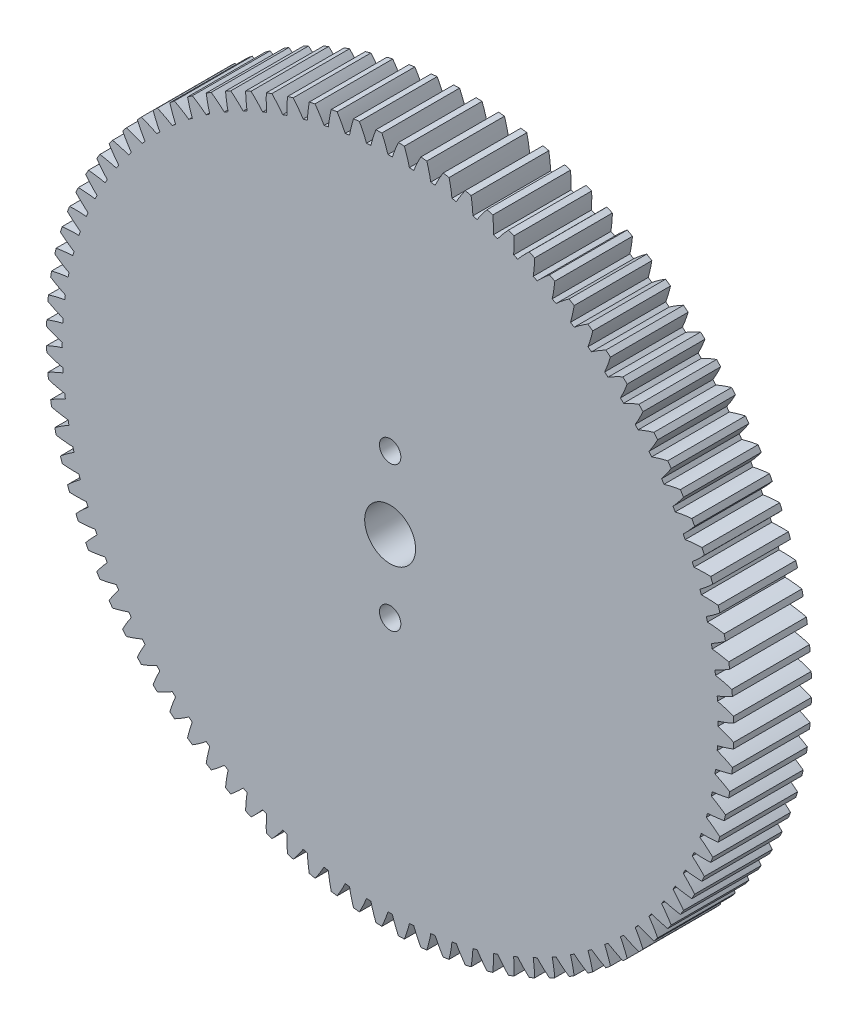
from build123d import *

# Parameters (mm, degrees)
MODEL_R             = 1.375
MODEL_R_2           = 3.275
BOSS_EXTRUDE1_DEPTH = 10


with BuildPart() as part:
    # Model → Boss-Extrude1 (new body)
    with BuildSketch(Plane.XY):
        with BuildLine():
            ThreePointArc((41.873890298, 5.228088781), (41.837981705, 5.508074786), (41.800201032, 5.787814326))
            ThreePointArc((41.800201032, 5.787814326), (42.763794154, 6.277066745), (43.695166566, 6.825177194))
            ThreePointArc((43.695166566, 6.825177194), (43.634301361, 7.204052311), (43.570151043, 7.582385053))
            ThreePointArc((43.570151043, 7.582385053), (42.512022114, 7.802027502), (41.442301719, 7.9555785))
            ThreePointArc((41.442301719, 7.9555785), (41.388158048, 8.232616499), (41.332162425, 8.509286121))
            ThreePointArc((41.332162425, 8.509286121), (42.261693781, 9.060513019), (43.155223915, 9.668364591))
            ThreePointArc((43.155223915, 9.668364591), (43.069709409, 10.042447733), (42.980952296, 10.415774804))
            ThreePointArc((42.980952296, 10.415774804), (41.910723599, 10.565742038), (40.833250841, 10.649001211))
            ThreePointArc((40.833250841, 10.649001211), (40.761103944, 10.921904884), (40.687133152, 11.194319847))
            ThreePointArc((40.687133152, 11.194319847), (41.578622347, 11.805160785), (42.430483969, 12.470150567))
            ThreePointArc((42.430483969, 12.470150567), (42.320686348, 12.837839852), (42.207702512, 13.204562608))
            ThreePointArc((42.207702512, 13.204562608), (41.129956931, 13.284212445), (40.049345714, 13.296823263))
            ThreePointArc((40.049345714, 13.296823263), (39.959504535, 13.564423996), (39.86787533, 13.831417776))
            ThreePointArc((39.86787533, 13.831417776), (40.717504868, 14.49925704), (41.524050177, 15.218537444))
            ThreePointArc((41.524050177, 15.218537444), (41.390439611, 15.578258369), (41.253712866, 15.936806448))
            ThreePointArc((41.253712866, 15.936806448), (40.173065472, 15.945797815), (39.09394314, 15.887706277))
            ThreePointArc((39.09394314, 15.887706277), (38.986792392, 16.148858162), (38.877897144, 16.409287452))
            ThreePointArc((38.877897144, 16.409287452), (39.682028783, 17.13126525), (40.439804027, 17.901756207))
            ThreePointArc((40.439804027, 17.901756207), (40.282952657, 18.251968393), (40.123068489, 18.600806436))
            ThreePointArc((40.123068489, 18.600806436), (39.04414678, 18.53910083), (37.9711343, 18.410555694))
            ThreePointArc((37.9711343, 18.410555694), (37.84713282, 18.664140439), (37.721437834, 18.916890039))
            ThreePointArc((37.721437834, 18.916890039), (38.476628158, 19.689914753), (39.182388427, 20.508316902))
            ThreePointArc((39.182388427, 20.508316902), (39.002967916, 20.847520686), (38.820610972, 21.185154915))
            ThreePointArc((38.820610972, 21.185154915), (37.748035057, 21.05301657), (36.685727234, 20.854568285))
            ThreePointArc((36.685727234, 20.854568285), (36.545406014, 21.0995), (36.403449536, 21.343487598))
            ThreePointArc((36.403449536, 21.343487598), (37.106464705, 22.164249018), (37.757187825, 23.027057835))
            ThreePointArc((37.757187825, 23.027057835), (37.555966478, 23.353800695), (37.351917639, 23.678785308))
            ThreePointArc((37.351917639, 23.678785308), (36.290280453, 23.47678006), (35.243226251, 23.209278412))
            ThreePointArc((35.243226251, 23.209278412), (35.08718617, 23.444508263), (34.929576079, 23.678689068))
            ThreePointArc((34.929576079, 23.678689068), (35.577405672, 24.543672566), (36.170305149, 25.447193371))
            ThreePointArc((36.170305149, 25.447193371), (35.948144626, 25.760076144), (35.723277661, 26.071019508))
            ThreePointArc((35.723277661, 26.071019508), (34.677125297, 25.800012374), (33.649808363, 25.464602847))
            ThreePointArc((33.649808363, 25.464602847), (33.478717607, 25.689123543), (33.306128814, 25.912494755))
            ThreePointArc((33.306128814, 25.912494755), (33.895998727, 26.81799634), (34.428535672, 27.758360119))
            ThreePointArc((34.428535672, 27.758360119), (34.1863873, 28.056042992), (33.941665123, 28.351613599))
            ThreePointArc((33.941665123, 28.351613599), (32.915477366, 28.012765075), (31.91229683, 27.610883942))
            ThreePointArc((31.91229683, 27.610883942), (31.726888036, 27.823734051), (31.540059592, 28.035339162))
            ThreePointArc((31.540059592, 28.035339162), (32.069443912, 28.977481336), (32.53933792, 29.950661307))
            ThreePointArc((32.53933792, 29.950661307), (32.278238615, 30.231869557), (32.014709165, 30.510801728))
            ThreePointArc((32.014709165, 30.510801728), (31.012880309, 30.105562814), (30.038131942, 29.638930994))
            ThreePointArc((30.038131942, 29.638930994), (29.839199059, 29.839199059), (29.638930994, 30.038131942))
            ThreePointArc((29.638930994, 30.038131942), (30.105562814, 31.012880309), (30.510801728, 32.014709165))
            ThreePointArc((30.510801728, 32.014709165), (30.231869557, 32.278238615), (29.950661307, 32.53933792))
            ThreePointArc((29.950661307, 32.53933792), (28.977481336, 32.069443912), (28.035339162, 31.540059593))
            ThreePointArc((28.035339162, 31.540059593), (27.823734051, 31.726888036), (27.610883942, 31.91229683))
            ThreePointArc((27.610883942, 31.91229683), (28.012765075, 32.915477366), (28.351613599, 33.941665123))
            ThreePointArc((28.351613599, 33.941665123), (28.056042992, 34.1863873), (27.758360119, 34.428535672))
            ThreePointArc((27.758360119, 34.428535672), (26.81799634, 33.895998727), (25.912494755, 33.306128814))
            ThreePointArc((25.912494755, 33.306128814), (25.689123543, 33.478717607), (25.464602846, 33.649808363))
            ThreePointArc((25.464602846, 33.649808363), (25.800012374, 34.677125297), (26.071019508, 35.723277661))
            ThreePointArc((26.071019508, 35.723277661), (25.760076144, 35.948144626), (25.447193371, 36.170305149))
            ThreePointArc((25.447193371, 36.170305149), (24.543672566, 35.577405673), (23.678689068, 34.929576079))
            ThreePointArc((23.678689068, 34.929576079), (23.444508263, 35.08718617), (23.209278412, 35.243226251))
            ThreePointArc((23.209278412, 35.243226251), (23.47678006, 36.290280453), (23.678785308, 37.351917639))
            ThreePointArc((23.678785308, 37.351917639), (23.353800695, 37.555966478), (23.027057835, 37.757187825))
            ThreePointArc((23.027057835, 37.757187825), (22.164249018, 37.106464705), (21.343487598, 36.403449536))
            ThreePointArc((21.343487598, 36.403449536), (21.0995, 36.545406014), (20.854568285, 36.685727234))
            ThreePointArc((20.854568285, 36.685727234), (21.05301657, 37.748035057), (21.185154915, 38.820610972))
            ThreePointArc((21.185154915, 38.820610972), (20.847520686, 39.002967916), (20.508316902, 39.182388427))
            ThreePointArc((20.508316902, 39.182388427), (19.689914753, 38.476628158), (18.916890039, 37.721437834))
            ThreePointArc((18.916890039, 37.721437834), (18.664140439, 37.84713282), (18.410555694, 37.9711343))
            ThreePointArc((18.410555694, 37.9711343), (18.53910083, 39.04414678), (18.600806436, 40.123068489))
            ThreePointArc((18.600806436, 40.123068489), (18.251968393, 40.282952657), (17.901756207, 40.439804027))
            ThreePointArc((17.901756207, 40.439804027), (17.13126525, 39.682028783), (16.409287452, 38.877897144))
            ThreePointArc((16.409287452, 38.877897144), (16.148858162, 38.986792392), (15.887706277, 39.09394314))
            ThreePointArc((15.887706277, 39.09394314), (15.945797815, 40.173065472), (15.936806448, 41.253712866))
            ThreePointArc((15.936806448, 41.253712866), (15.578258369, 41.390439611), (15.218537444, 41.524050177))
            ThreePointArc((15.218537444, 41.524050177), (14.49925704, 40.717504868), (13.831417776, 39.86787533))
            ThreePointArc((13.831417776, 39.86787533), (13.564423996, 39.959504535), (13.296823263, 40.049345714))
            ThreePointArc((13.296823263, 40.049345714), (13.284212445, 41.129956931), (13.204562608, 42.207702512))
            ThreePointArc((13.204562608, 42.207702512), (12.837839852, 42.320686348), (12.470150567, 42.430483969))
            ThreePointArc((12.470150567, 42.430483969), (11.805160785, 41.578622347), (11.194319847, 40.687133152))
            ThreePointArc((11.194319847, 40.687133152), (10.921904884, 40.761103944), (10.649001211, 40.833250841))
            ThreePointArc((10.649001211, 40.833250841), (10.565742038, 41.910723599), (10.415774804, 42.980952295))
            ThreePointArc((10.415774804, 42.980952295), (10.042447733, 43.069709409), (9.668364591, 43.155223915))
            ThreePointArc((9.668364591, 43.155223915), (9.060513019, 42.261693781), (8.509286121, 41.332162425))
            ThreePointArc((8.509286121, 41.332162425), (8.232616499, 41.388158048), (7.9555785, 41.442301719))
            ThreePointArc((7.9555785, 41.442301719), (7.802027502, 42.512022114), (7.582385053, 43.570151043))
            ThreePointArc((7.582385053, 43.570151043), (7.204052311, 43.634301361), (6.825177194, 43.695166566))
            ThreePointArc((6.825177194, 43.695166566), (6.277066745, 42.763794154), (5.787814326, 41.800201032))
            ThreePointArc((5.787814326, 41.800201032), (5.508074785, 41.837981705), (5.228088781, 41.873890298))
            ThreePointArc((5.228088781, 41.873890298), (5.004903486, 42.931277625), (4.716526366, 43.972775715))
            ThreePointArc((4.716526366, 43.972775715), (4.334808031, 44.012044537), (3.95276334, 44.047999807))
            ThreePointArc((3.95276334, 44.047999807), (3.466741108, 43.082773396), (3.041558221, 42.089244761))
            ThreePointArc((3.041558221, 42.089244761), (2.75994665, 42.108648702), (2.478211583, 42.126168451))
            ThreePointArc((2.478211583, 42.126168451), (2.186347705, 43.166694813), (1.830470788, 44.18710221))
            ThreePointArc((1.830470788, 44.18710221), (1.447001438, 44.201321381), (1.063423147, 44.21221275))
            ThreePointArc((1.063423147, 44.21221275), (0.641570353, 43.217265588), (0.282277697, 42.198055883))
            ThreePointArc((0.282277697, 42.198055883), (0, 42.199), (-0.282277698, 42.198055883))
            ThreePointArc((-0.282277698, 42.198055883), (-0.641570353, 43.217265588), (-1.063423147, 44.21221275))
            ThreePointArc((-1.063423147, 44.21221275), (-1.447001438, 44.201321381), (-1.830470788, 44.18710221))
            ThreePointArc((-1.830470788, 44.18710221), (-2.186347705, 43.166694813), (-2.478211583, 42.126168451))
            ThreePointArc((-2.478211583, 42.126168451), (-2.75994665, 42.108648702), (-3.041558221, 42.089244761))
            ThreePointArc((-3.041558221, 42.089244761), (-3.466741108, 43.082773396), (-3.95276334, 44.047999807))
            ThreePointArc((-3.95276334, 44.047999807), (-4.334808031, 44.012044537), (-4.716526366, 43.972775715))
            ThreePointArc((-4.716526366, 43.972775715), (-5.004903486, 42.931277625), (-5.228088781, 41.873890298))
            ThreePointArc((-5.228088781, 41.873890298), (-5.508074786, 41.837981705), (-5.787814326, 41.800201032))
            ThreePointArc((-5.787814326, 41.800201032), (-6.277066745, 42.763794154), (-6.825177194, 43.695166566))
            ThreePointArc((-6.825177194, 43.695166566), (-7.204052311, 43.634301361), (-7.582385053, 43.570151043))
            ThreePointArc((-7.582385053, 43.570151043), (-7.802027502, 42.512022114), (-7.9555785, 41.442301719))
            ThreePointArc((-7.9555785, 41.442301719), (-8.232616499, 41.388158048), (-8.509286121, 41.332162425))
            ThreePointArc((-8.509286121, 41.332162425), (-9.060513019, 42.261693781), (-9.668364591, 43.155223915))
            ThreePointArc((-9.668364591, 43.155223915), (-10.042447733, 43.069709409), (-10.415774804, 42.980952296))
            ThreePointArc((-10.415774804, 42.980952296), (-10.565742038, 41.910723599), (-10.649001211, 40.833250841))
            ThreePointArc((-10.649001211, 40.833250841), (-10.921904884, 40.761103944), (-11.194319847, 40.687133152))
            ThreePointArc((-11.194319847, 40.687133152), (-11.805160785, 41.578622347), (-12.470150567, 42.430483969))
            ThreePointArc((-12.470150567, 42.430483969), (-12.837839852, 42.320686348), (-13.204562608, 42.207702512))
            ThreePointArc((-13.204562608, 42.207702512), (-13.284212445, 41.129956931), (-13.296823263, 40.049345714))
            ThreePointArc((-13.296823263, 40.049345714), (-13.564423996, 39.959504535), (-13.831417776, 39.86787533))
            ThreePointArc((-13.831417776, 39.86787533), (-14.49925704, 40.717504868), (-15.218537444, 41.524050177))
            ThreePointArc((-15.218537444, 41.524050177), (-15.578258369, 41.390439611), (-15.936806448, 41.253712866))
            ThreePointArc((-15.936806448, 41.253712866), (-15.945797815, 40.173065472), (-15.887706277, 39.09394314))
            ThreePointArc((-15.887706277, 39.09394314), (-16.148858162, 38.986792392), (-16.409287451, 38.877897143))
            ThreePointArc((-16.409287451, 38.877897143), (-17.13126525, 39.682028782), (-17.901756207, 40.439804026))
            ThreePointArc((-17.901756207, 40.439804026), (-18.251968393, 40.282952657), (-18.600806436, 40.123068488))
            ThreePointArc((-18.600806436, 40.123068488), (-18.53910083, 39.04414678), (-18.410555694, 37.9711343))
            ThreePointArc((-18.410555694, 37.9711343), (-18.664140438, 37.847132819), (-18.916890038, 37.721437833))
            ThreePointArc((-18.916890038, 37.721437833), (-19.689914753, 38.476628158), (-20.508316901, 39.182388427))
            ThreePointArc((-20.508316901, 39.182388427), (-20.847520686, 39.002967915), (-21.185154915, 38.820610971))
            ThreePointArc((-21.185154915, 38.820610971), (-21.05301657, 37.748035057), (-20.854568284, 36.685727233))
            ThreePointArc((-20.854568284, 36.685727233), (-21.0995, 36.545406014), (-21.343487598, 36.403449536))
            ThreePointArc((-21.343487598, 36.403449536), (-22.164249018, 37.106464704), (-23.027057834, 37.757187825))
            ThreePointArc((-23.027057834, 37.757187825), (-23.353800695, 37.555966478), (-23.678785308, 37.351917639))
            ThreePointArc((-23.678785308, 37.351917639), (-23.47678006, 36.290280453), (-23.209278412, 35.243226251))
            ThreePointArc((-23.209278412, 35.243226251), (-23.444508263, 35.087186169), (-23.678689067, 34.929576078))
            ThreePointArc((-23.678689067, 34.929576078), (-24.543672565, 35.577405672), (-25.447193371, 36.170305148))
            ThreePointArc((-25.447193371, 36.170305148), (-25.760076144, 35.948144626), (-26.071019507, 35.72327766))
            ThreePointArc((-26.071019507, 35.72327766), (-25.800012374, 34.677125297), (-25.464602846, 33.649808363))
            ThreePointArc((-25.464602846, 33.649808363), (-25.689123542, 33.478717607), (-25.912494755, 33.306128814))
            ThreePointArc((-25.912494755, 33.306128814), (-26.817996339, 33.895998727), (-27.758360118, 34.428535672))
            ThreePointArc((-27.758360118, 34.428535672), (-28.056042992, 34.1863873), (-28.351613599, 33.941665123))
            ThreePointArc((-28.351613599, 33.941665123), (-28.012765074, 32.915477366), (-27.610883942, 31.912296829))
            ThreePointArc((-27.610883942, 31.912296829), (-27.823734051, 31.726888035), (-28.035339161, 31.540059592))
            ThreePointArc((-28.035339161, 31.540059592), (-28.977481336, 32.069443912), (-29.950661306, 32.53933792))
            ThreePointArc((-29.950661306, 32.53933792), (-30.231869557, 32.278238615), (-30.510801728, 32.014709164))
            ThreePointArc((-30.510801728, 32.014709164), (-30.105562814, 31.012880308), (-29.638930993, 30.038131941))
            ThreePointArc((-29.638930993, 30.038131941), (-29.839199059, 29.839199059), (-30.038131941, 29.638930993))
            ThreePointArc((-30.038131941, 29.638930993), (-31.012880308, 30.105562814), (-32.014709164, 30.510801728))
            ThreePointArc((-32.014709164, 30.510801728), (-32.278238615, 30.231869557), (-32.53933792, 29.950661306))
            ThreePointArc((-32.53933792, 29.950661306), (-32.069443912, 28.977481336), (-31.540059592, 28.035339161))
            ThreePointArc((-31.540059592, 28.035339161), (-31.726888035, 27.823734051), (-31.912296829, 27.610883942))
            ThreePointArc((-31.912296829, 27.610883942), (-32.915477366, 28.012765074), (-33.941665123, 28.351613599))
            ThreePointArc((-33.941665123, 28.351613599), (-34.1863873, 28.056042992), (-34.428535672, 27.758360118))
            ThreePointArc((-34.428535672, 27.758360118), (-33.895998727, 26.817996339), (-33.306128814, 25.912494755))
            ThreePointArc((-33.306128814, 25.912494755), (-33.478717607, 25.689123542), (-33.649808363, 25.464602846))
            ThreePointArc((-33.649808363, 25.464602846), (-34.677125297, 25.800012374), (-35.723277661, 26.071019507))
            ThreePointArc((-35.723277661, 26.071019507), (-35.948144626, 25.760076144), (-36.170305148, 25.447193371))
            ThreePointArc((-36.170305148, 25.447193371), (-35.577405672, 24.543672565), (-34.929576078, 23.678689067))
            ThreePointArc((-34.929576078, 23.678689067), (-35.087186169, 23.444508263), (-35.243226251, 23.209278412))
            ThreePointArc((-35.243226251, 23.209278412), (-36.290280453, 23.47678006), (-37.351917639, 23.678785308))
            ThreePointArc((-37.351917639, 23.678785308), (-37.555966478, 23.353800695), (-37.757187825, 23.027057834))
            ThreePointArc((-37.757187825, 23.027057834), (-37.106464704, 22.164249018), (-36.403449536, 21.343487598))
            ThreePointArc((-36.403449536, 21.343487598), (-36.545406014, 21.0995), (-36.685727233, 20.854568284))
            ThreePointArc((-36.685727233, 20.854568284), (-37.748035057, 21.05301657), (-38.820610972, 21.185154915))
            ThreePointArc((-38.820610972, 21.185154915), (-39.002967916, 20.847520686), (-39.182388427, 20.508316901))
            ThreePointArc((-39.182388427, 20.508316901), (-38.476628158, 19.689914753), (-37.721437834, 18.916890039))
            ThreePointArc((-37.721437834, 18.916890039), (-37.84713282, 18.664140438), (-37.9711343, 18.410555694))
            ThreePointArc((-37.9711343, 18.410555694), (-39.04414678, 18.53910083), (-40.123068488, 18.600806436))
            ThreePointArc((-40.123068488, 18.600806436), (-40.282952657, 18.251968393), (-40.439804026, 17.901756207))
            ThreePointArc((-40.439804026, 17.901756207), (-39.682028783, 17.13126525), (-38.877897144, 16.409287452))
            ThreePointArc((-38.877897144, 16.409287452), (-38.986792392, 16.148858162), (-39.09394314, 15.887706277))
            ThreePointArc((-39.09394314, 15.887706277), (-40.173065472, 15.945797815), (-41.253712866, 15.936806448))
            ThreePointArc((-41.253712866, 15.936806448), (-41.390439611, 15.578258369), (-41.524050176, 15.218537444))
            ThreePointArc((-41.524050176, 15.218537444), (-40.717504868, 14.49925704), (-39.867875329, 13.831417776))
            ThreePointArc((-39.867875329, 13.831417776), (-39.959504534, 13.564423996), (-40.049345714, 13.296823263))
            ThreePointArc((-40.049345714, 13.296823263), (-41.12995693, 13.284212445), (-42.207702512, 13.204562608))
            ThreePointArc((-42.207702512, 13.204562608), (-42.320686348, 12.837839852), (-42.430483969, 12.470150567))
            ThreePointArc((-42.430483969, 12.470150567), (-41.578622346, 11.805160785), (-40.687133152, 11.194319847))
            ThreePointArc((-40.687133152, 11.194319847), (-40.761103943, 10.921904884), (-40.833250841, 10.649001211))
            ThreePointArc((-40.833250841, 10.649001211), (-41.910723599, 10.565742038), (-42.980952295, 10.415774804))
            ThreePointArc((-42.980952295, 10.415774804), (-43.069709408, 10.042447733), (-43.155223915, 9.668364591))
            ThreePointArc((-43.155223915, 9.668364591), (-42.261693781, 9.060513019), (-41.332162425, 8.509286121))
            ThreePointArc((-41.332162425, 8.509286121), (-41.388158048, 8.232616499), (-41.442301718, 7.9555785))
            ThreePointArc((-41.442301718, 7.9555785), (-42.512022114, 7.802027502), (-43.570151043, 7.582385053))
            ThreePointArc((-43.570151043, 7.582385053), (-43.634301361, 7.204052311), (-43.695166566, 6.825177194))
            ThreePointArc((-43.695166566, 6.825177194), (-42.763794154, 6.277066745), (-41.800201032, 5.787814326))
            ThreePointArc((-41.800201032, 5.787814326), (-41.837981705, 5.508074785), (-41.873890298, 5.228088781))
            ThreePointArc((-41.873890298, 5.228088781), (-42.931277625, 5.004903486), (-43.972775715, 4.716526366))
            ThreePointArc((-43.972775715, 4.716526366), (-44.012044537, 4.334808031), (-44.047999807, 3.95276334))
            ThreePointArc((-44.047999807, 3.95276334), (-43.082773396, 3.466741108), (-42.089244761, 3.041558221))
            ThreePointArc((-42.089244761, 3.041558221), (-42.108648702, 2.75994665), (-42.126168451, 2.478211583))
            ThreePointArc((-42.126168451, 2.478211583), (-43.166694813, 2.186347705), (-44.18710221, 1.830470788))
            ThreePointArc((-44.18710221, 1.830470788), (-44.201321381, 1.447001438), (-44.21221275, 1.063423147))
            ThreePointArc((-44.21221275, 1.063423147), (-43.217265588, 0.641570353), (-42.198055883, 0.282277697))
            ThreePointArc((-42.198055883, 0.282277697), (-42.199, 0), (-42.198055883, -0.282277698))
            ThreePointArc((-42.198055883, -0.282277698), (-43.217265588, -0.641570353), (-44.21221275, -1.063423147))
            ThreePointArc((-44.21221275, -1.063423147), (-44.201321381, -1.447001438), (-44.18710221, -1.830470788))
            ThreePointArc((-44.18710221, -1.830470788), (-43.166694813, -2.186347705), (-42.126168451, -2.478211583))
            ThreePointArc((-42.126168451, -2.478211583), (-42.108648702, -2.75994665), (-42.089244761, -3.041558221))
            ThreePointArc((-42.089244761, -3.041558221), (-43.082773396, -3.466741108), (-44.047999807, -3.95276334))
            ThreePointArc((-44.047999807, -3.95276334), (-44.012044537, -4.334808031), (-43.972775715, -4.716526366))
            ThreePointArc((-43.972775715, -4.716526366), (-42.931277625, -5.004903486), (-41.873890298, -5.228088781))
            ThreePointArc((-41.873890298, -5.228088781), (-41.837981705, -5.508074786), (-41.800201032, -5.787814326))
            ThreePointArc((-41.800201032, -5.787814326), (-42.763794154, -6.277066745), (-43.695166567, -6.825177194))
            ThreePointArc((-43.695166567, -6.825177194), (-43.634301362, -7.204052311), (-43.570151043, -7.582385053))
            ThreePointArc((-43.570151043, -7.582385053), (-42.512022115, -7.802027502), (-41.442301719, -7.9555785))
            ThreePointArc((-41.442301719, -7.9555785), (-41.388158048, -8.232616499), (-41.332162425, -8.509286121))
            ThreePointArc((-41.332162425, -8.509286121), (-42.261693781, -9.060513019), (-43.155223915, -9.668364591))
            ThreePointArc((-43.155223915, -9.668364591), (-43.069709409, -10.042447733), (-42.980952296, -10.415774804))
            ThreePointArc((-42.980952296, -10.415774804), (-41.910723599, -10.565742038), (-40.833250841, -10.649001211))
            ThreePointArc((-40.833250841, -10.649001211), (-40.761103944, -10.921904884), (-40.687133153, -11.194319847))
            ThreePointArc((-40.687133153, -11.194319847), (-41.578622347, -11.805160785), (-42.430483969, -12.470150567))
            ThreePointArc((-42.430483969, -12.470150567), (-42.320686348, -12.837839852), (-42.207702512, -13.204562608))
            ThreePointArc((-42.207702512, -13.204562608), (-41.129956931, -13.284212445), (-40.049345714, -13.296823263))
            ThreePointArc((-40.049345714, -13.296823263), (-39.959504535, -13.564423996), (-39.86787533, -13.831417776))
            ThreePointArc((-39.86787533, -13.831417776), (-40.717504868, -14.49925704), (-41.524050177, -15.218537444))
            ThreePointArc((-41.524050177, -15.218537444), (-41.390439611, -15.578258369), (-41.253712866, -15.936806448))
            ThreePointArc((-41.253712866, -15.936806448), (-40.173065472, -15.945797815), (-39.09394314, -15.887706277))
            ThreePointArc((-39.09394314, -15.887706277), (-38.986792393, -16.148858162), (-38.877897144, -16.409287452))
            ThreePointArc((-38.877897144, -16.409287452), (-39.682028783, -17.13126525), (-40.439804027, -17.901756207))
            ThreePointArc((-40.439804027, -17.901756207), (-40.282952657, -18.251968393), (-40.123068489, -18.600806436))
            ThreePointArc((-40.123068489, -18.600806436), (-39.04414678, -18.53910083), (-37.9711343, -18.410555694))
            ThreePointArc((-37.9711343, -18.410555694), (-37.84713282, -18.664140439), (-37.721437834, -18.916890039))
            ThreePointArc((-37.721437834, -18.916890039), (-38.476628158, -19.689914753), (-39.182388428, -20.508316902))
            ThreePointArc((-39.182388428, -20.508316902), (-39.002967916, -20.847520686), (-38.820610972, -21.185154915))
            ThreePointArc((-38.820610972, -21.185154915), (-37.748035058, -21.05301657), (-36.685727234, -20.854568285))
            ThreePointArc((-36.685727234, -20.854568285), (-36.545406015, -21.0995), (-36.403449537, -21.343487599))
            ThreePointArc((-36.403449537, -21.343487599), (-37.106464705, -22.164249018), (-37.757187826, -23.027057835))
            ThreePointArc((-37.757187826, -23.027057835), (-37.555966478, -23.353800695), (-37.351917639, -23.678785308))
            ThreePointArc((-37.351917639, -23.678785308), (-36.290280454, -23.476780061), (-35.243226251, -23.209278412))
            ThreePointArc((-35.243226251, -23.209278412), (-35.08718617, -23.444508263), (-34.929576079, -23.678689068))
            ThreePointArc((-34.929576079, -23.678689068), (-35.577405673, -24.543672566), (-36.170305149, -25.447193371))
            ThreePointArc((-36.170305149, -25.447193371), (-35.948144626, -25.760076144), (-35.723277661, -26.071019508))
            ThreePointArc((-35.723277661, -26.071019508), (-34.677125297, -25.800012375), (-33.649808363, -25.464602847))
            ThreePointArc((-33.649808363, -25.464602847), (-33.478717607, -25.689123543), (-33.306128814, -25.912494755))
            ThreePointArc((-33.306128814, -25.912494755), (-33.895998728, -26.81799634), (-34.428535672, -27.758360119))
            ThreePointArc((-34.428535672, -27.758360119), (-34.1863873, -28.056042992), (-33.941665124, -28.351613599))
            ThreePointArc((-33.941665124, -28.351613599), (-32.915477367, -28.012765075), (-31.91229683, -27.610883942))
            ThreePointArc((-31.91229683, -27.610883942), (-31.726888036, -27.823734052), (-31.540059593, -28.035339162))
            ThreePointArc((-31.540059593, -28.035339162), (-32.069443912, -28.977481336), (-32.539337921, -29.950661307))
            ThreePointArc((-32.539337921, -29.950661307), (-32.278238615, -30.231869557), (-32.014709165, -30.510801729))
            ThreePointArc((-32.014709165, -30.510801729), (-31.012880309, -30.105562814), (-30.038131942, -29.638930994))
            ThreePointArc((-30.038131942, -29.638930994), (-29.83919906, -29.83919906), (-29.638930994, -30.038131942))
            ThreePointArc((-29.638930994, -30.038131942), (-30.105562815, -31.012880309), (-30.510801729, -32.014709165))
            ThreePointArc((-30.510801729, -32.014709165), (-30.231869557, -32.278238615), (-29.950661307, -32.539337921))
            ThreePointArc((-29.950661307, -32.539337921), (-28.977481336, -32.069443912), (-28.035339162, -31.540059593))
            ThreePointArc((-28.035339162, -31.540059593), (-27.823734052, -31.726888036), (-27.610883942, -31.91229683))
            ThreePointArc((-27.610883942, -31.91229683), (-28.012765075, -32.915477367), (-28.351613599, -33.941665123))
            ThreePointArc((-28.351613599, -33.941665123), (-28.056042992, -34.1863873), (-27.758360119, -34.428535672))
            ThreePointArc((-27.758360119, -34.428535672), (-26.81799634, -33.895998728), (-25.912494755, -33.306128814))
            ThreePointArc((-25.912494755, -33.306128814), (-25.689123543, -33.478717607), (-25.464602847, -33.649808363))
            ThreePointArc((-25.464602847, -33.649808363), (-25.800012375, -34.677125297), (-26.071019508, -35.723277661))
            ThreePointArc((-26.071019508, -35.723277661), (-25.760076144, -35.948144626), (-25.447193371, -36.170305149))
            ThreePointArc((-25.447193371, -36.170305149), (-24.543672566, -35.577405673), (-23.678689068, -34.929576079))
            ThreePointArc((-23.678689068, -34.929576079), (-23.444508263, -35.08718617), (-23.209278412, -35.243226251))
            ThreePointArc((-23.209278412, -35.243226251), (-23.476780061, -36.290280454), (-23.678785308, -37.35191764))
            ThreePointArc((-23.678785308, -37.35191764), (-23.353800695, -37.555966478), (-23.027057835, -37.757187826))
            ThreePointArc((-23.027057835, -37.757187826), (-22.164249018, -37.106464705), (-21.343487599, -36.403449537))
            ThreePointArc((-21.343487599, -36.403449537), (-21.0995, -36.545406015), (-20.854568285, -36.685727234))
            ThreePointArc((-20.854568285, -36.685727234), (-21.05301657, -37.748035058), (-21.185154915, -38.820610972))
            ThreePointArc((-21.185154915, -38.820610972), (-20.847520686, -39.002967916), (-20.508316902, -39.182388428))
            ThreePointArc((-20.508316902, -39.182388428), (-19.689914753, -38.476628158), (-18.916890039, -37.721437834))
            ThreePointArc((-18.916890039, -37.721437834), (-18.664140439, -37.84713282), (-18.410555694, -37.971134301))
            ThreePointArc((-18.410555694, -37.971134301), (-18.539100831, -39.044146781), (-18.600806436, -40.123068489))
            ThreePointArc((-18.600806436, -40.123068489), (-18.251968393, -40.282952658), (-17.901756207, -40.439804027))
            ThreePointArc((-17.901756207, -40.439804027), (-17.13126525, -39.682028783), (-16.409287452, -38.877897144))
            ThreePointArc((-16.409287452, -38.877897144), (-16.148858163, -38.986792393), (-15.887706277, -39.093943141))
            ThreePointArc((-15.887706277, -39.093943141), (-15.945797815, -40.173065473), (-15.936806448, -41.253712866))
            ThreePointArc((-15.936806448, -41.253712866), (-15.578258369, -41.390439611), (-15.218537444, -41.524050177))
            ThreePointArc((-15.218537444, -41.524050177), (-14.49925704, -40.717504868), (-13.831417777, -39.86787533))
            ThreePointArc((-13.831417777, -39.86787533), (-13.564423996, -39.959504535), (-13.296823263, -40.049345714))
            ThreePointArc((-13.296823263, -40.049345714), (-13.284212445, -41.129956931), (-13.204562608, -42.207702512))
            ThreePointArc((-13.204562608, -42.207702512), (-12.837839852, -42.320686348), (-12.470150567, -42.430483969))
            ThreePointArc((-12.470150567, -42.430483969), (-11.805160785, -41.578622347), (-11.194319847, -40.687133152))
            ThreePointArc((-11.194319847, -40.687133152), (-10.921904884, -40.761103944), (-10.649001211, -40.833250841))
            ThreePointArc((-10.649001211, -40.833250841), (-10.565742038, -41.910723599), (-10.415774804, -42.980952295))
            ThreePointArc((-10.415774804, -42.980952295), (-10.042447733, -43.069709408), (-9.668364591, -43.155223915))
            ThreePointArc((-9.668364591, -43.155223915), (-9.060513019, -42.261693781), (-8.509286121, -41.332162425))
            ThreePointArc((-8.509286121, -41.332162425), (-8.232616499, -41.388158048), (-7.9555785, -41.442301719))
            ThreePointArc((-7.9555785, -41.442301719), (-7.802027502, -42.512022114), (-7.582385053, -43.570151043))
            ThreePointArc((-7.582385053, -43.570151043), (-7.204052311, -43.634301361), (-6.825177194, -43.695166566))
            ThreePointArc((-6.825177194, -43.695166566), (-6.277066745, -42.763794154), (-5.787814326, -41.800201032))
            ThreePointArc((-5.787814326, -41.800201032), (-5.508074786, -41.837981705), (-5.228088781, -41.873890298))
            ThreePointArc((-5.228088781, -41.873890298), (-5.004903486, -42.931277625), (-4.716526366, -43.972775714))
            ThreePointArc((-4.716526366, -43.972775714), (-4.334808031, -44.012044537), (-3.95276334, -44.047999807))
            ThreePointArc((-3.95276334, -44.047999807), (-3.466741108, -43.082773396), (-3.041558221, -42.089244761))
            ThreePointArc((-3.041558221, -42.089244761), (-2.75994665, -42.108648702), (-2.478211583, -42.126168451))
            ThreePointArc((-2.478211583, -42.126168451), (-2.186347705, -43.166694813), (-1.830470788, -44.18710221))
            ThreePointArc((-1.830470788, -44.18710221), (-1.447001438, -44.201321381), (-1.063423147, -44.21221275))
            ThreePointArc((-1.063423147, -44.21221275), (-0.641570353, -43.217265588), (-0.282277697, -42.198055883))
            ThreePointArc((-0.282277697, -42.198055883), (0, -42.199), (0.282277697, -42.198055883))
            ThreePointArc((0.282277697, -42.198055883), (0.641570353, -43.217265588), (1.063423147, -44.21221275))
            ThreePointArc((1.063423147, -44.21221275), (1.447001438, -44.201321381), (1.830470788, -44.18710221))
            ThreePointArc((1.830470788, -44.18710221), (2.186347705, -43.166694813), (2.478211583, -42.126168451))
            ThreePointArc((2.478211583, -42.126168451), (2.75994665, -42.108648702), (3.041558221, -42.089244761))
            ThreePointArc((3.041558221, -42.089244761), (3.466741108, -43.082773396), (3.95276334, -44.047999807))
            ThreePointArc((3.95276334, -44.047999807), (4.334808031, -44.012044537), (4.716526366, -43.972775715))
            ThreePointArc((4.716526366, -43.972775715), (5.004903486, -42.931277625), (5.228088781, -41.873890298))
            ThreePointArc((5.228088781, -41.873890298), (5.508074785, -41.837981705), (5.787814326, -41.800201032))
            ThreePointArc((5.787814326, -41.800201032), (6.277066745, -42.763794154), (6.825177194, -43.695166566))
            ThreePointArc((6.825177194, -43.695166566), (7.204052311, -43.634301361), (7.582385053, -43.570151043))
            ThreePointArc((7.582385053, -43.570151043), (7.802027502, -42.512022114), (7.9555785, -41.442301719))
            ThreePointArc((7.9555785, -41.442301719), (8.232616499, -41.388158048), (8.509286121, -41.332162425))
            ThreePointArc((8.509286121, -41.332162425), (9.060513019, -42.261693781), (9.668364591, -43.155223915))
            ThreePointArc((9.668364591, -43.155223915), (10.042447733, -43.069709409), (10.415774804, -42.980952296))
            ThreePointArc((10.415774804, -42.980952296), (10.565742038, -41.910723599), (10.649001211, -40.833250841))
            ThreePointArc((10.649001211, -40.833250841), (10.921904884, -40.761103944), (11.194319847, -40.687133152))
            ThreePointArc((11.194319847, -40.687133152), (11.805160785, -41.578622347), (12.470150567, -42.430483969))
            ThreePointArc((12.470150567, -42.430483969), (12.837839852, -42.320686348), (13.204562608, -42.207702512))
            ThreePointArc((13.204562608, -42.207702512), (13.284212445, -41.129956931), (13.296823263, -40.049345714))
            ThreePointArc((13.296823263, -40.049345714), (13.564423996, -39.959504535), (13.831417776, -39.86787533))
            ThreePointArc((13.831417776, -39.86787533), (14.49925704, -40.717504868), (15.218537444, -41.524050177))
            ThreePointArc((15.218537444, -41.524050177), (15.578258369, -41.390439611), (15.936806448, -41.253712866))
            ThreePointArc((15.936806448, -41.253712866), (15.945797815, -40.173065472), (15.887706277, -39.09394314))
            ThreePointArc((15.887706277, -39.09394314), (16.148858162, -38.986792392), (16.409287452, -38.877897144))
            ThreePointArc((16.409287452, -38.877897144), (17.13126525, -39.682028783), (17.901756207, -40.439804027))
            ThreePointArc((17.901756207, -40.439804027), (18.251968393, -40.282952657), (18.600806436, -40.123068489))
            ThreePointArc((18.600806436, -40.123068489), (18.53910083, -39.04414678), (18.410555694, -37.9711343))
            ThreePointArc((18.410555694, -37.9711343), (18.664140439, -37.84713282), (18.916890039, -37.721437834))
            ThreePointArc((18.916890039, -37.721437834), (19.689914753, -38.476628158), (20.508316902, -39.182388427))
            ThreePointArc((20.508316902, -39.182388427), (20.847520686, -39.002967916), (21.185154915, -38.820610972))
            ThreePointArc((21.185154915, -38.820610972), (21.05301657, -37.748035057), (20.854568285, -36.685727234))
            ThreePointArc((20.854568285, -36.685727234), (21.0995, -36.545406014), (21.343487598, -36.403449536))
            ThreePointArc((21.343487598, -36.403449536), (22.164249018, -37.106464705), (23.027057835, -37.757187825))
            ThreePointArc((23.027057835, -37.757187825), (23.353800695, -37.555966478), (23.678785308, -37.351917639))
            ThreePointArc((23.678785308, -37.351917639), (23.47678006, -36.290280453), (23.209278412, -35.243226251))
            ThreePointArc((23.209278412, -35.243226251), (23.444508263, -35.08718617), (23.678689068, -34.929576079))
            ThreePointArc((23.678689068, -34.929576079), (24.543672566, -35.577405672), (25.447193371, -36.170305149))
            ThreePointArc((25.447193371, -36.170305149), (25.760076144, -35.948144626), (26.071019508, -35.723277661))
            ThreePointArc((26.071019508, -35.723277661), (25.800012374, -34.677125297), (25.464602846, -33.649808363))
            ThreePointArc((25.464602846, -33.649808363), (25.689123543, -33.478717607), (25.912494755, -33.306128814))
            ThreePointArc((25.912494755, -33.306128814), (26.81799634, -33.895998727), (27.758360119, -34.428535672))
            ThreePointArc((27.758360119, -34.428535672), (28.056042992, -34.1863873), (28.351613599, -33.941665123))
            ThreePointArc((28.351613599, -33.941665123), (28.012765075, -32.915477366), (27.610883942, -31.91229683))
            ThreePointArc((27.610883942, -31.91229683), (27.823734051, -31.726888036), (28.035339162, -31.540059593))
            ThreePointArc((28.035339162, -31.540059593), (28.977481336, -32.069443912), (29.950661306, -32.53933792))
            ThreePointArc((29.950661306, -32.53933792), (30.231869557, -32.278238615), (30.510801728, -32.014709165))
            ThreePointArc((30.510801728, -32.014709165), (30.105562814, -31.012880309), (29.638930994, -30.038131942))
            ThreePointArc((29.638930994, -30.038131942), (29.839199059, -29.839199059), (30.038131942, -29.638930994))
            ThreePointArc((30.038131942, -29.638930994), (31.012880309, -30.105562814), (32.014709165, -30.510801728))
            ThreePointArc((32.014709165, -30.510801728), (32.278238615, -30.231869557), (32.53933792, -29.950661307))
            ThreePointArc((32.53933792, -29.950661307), (32.069443912, -28.977481336), (31.540059593, -28.035339162))
            ThreePointArc((31.540059593, -28.035339162), (31.726888036, -27.823734051), (31.91229683, -27.610883942))
            ThreePointArc((31.91229683, -27.610883942), (32.915477366, -28.012765075), (33.941665123, -28.351613599))
            ThreePointArc((33.941665123, -28.351613599), (34.1863873, -28.056042992), (34.428535672, -27.758360119))
            ThreePointArc((34.428535672, -27.758360119), (33.895998727, -26.81799634), (33.306128814, -25.912494755))
            ThreePointArc((33.306128814, -25.912494755), (33.478717607, -25.689123543), (33.649808363, -25.464602846))
            ThreePointArc((33.649808363, -25.464602846), (34.677125297, -25.800012374), (35.723277661, -26.071019508))
            ThreePointArc((35.723277661, -26.071019508), (35.948144626, -25.760076144), (36.170305149, -25.447193371))
            ThreePointArc((36.170305149, -25.447193371), (35.577405672, -24.543672566), (34.929576079, -23.678689068))
            ThreePointArc((34.929576079, -23.678689068), (35.08718617, -23.444508263), (35.243226251, -23.209278412))
            ThreePointArc((35.243226251, -23.209278412), (36.290280453, -23.47678006), (37.351917639, -23.678785308))
            ThreePointArc((37.351917639, -23.678785308), (37.555966478, -23.353800695), (37.757187825, -23.027057835))
            ThreePointArc((37.757187825, -23.027057835), (37.106464705, -22.164249018), (36.403449536, -21.343487598))
            ThreePointArc((36.403449536, -21.343487598), (36.545406014, -21.0995), (36.685727234, -20.854568285))
            ThreePointArc((36.685727234, -20.854568285), (37.748035057, -21.05301657), (38.820610972, -21.185154915))
            ThreePointArc((38.820610972, -21.185154915), (39.002967916, -20.847520686), (39.182388427, -20.508316902))
            ThreePointArc((39.182388427, -20.508316902), (38.476628158, -19.689914753), (37.721437834, -18.916890039))
            ThreePointArc((37.721437834, -18.916890039), (37.84713282, -18.664140439), (37.9711343, -18.410555694))
            ThreePointArc((37.9711343, -18.410555694), (39.04414678, -18.53910083), (40.123068489, -18.600806436))
            ThreePointArc((40.123068489, -18.600806436), (40.282952657, -18.251968393), (40.439804027, -17.901756207))
            ThreePointArc((40.439804027, -17.901756207), (39.682028783, -17.13126525), (38.877897144, -16.409287452))
            ThreePointArc((38.877897144, -16.409287452), (38.986792392, -16.148858162), (39.09394314, -15.887706277))
            ThreePointArc((39.09394314, -15.887706277), (40.173065472, -15.945797815), (41.253712866, -15.936806448))
            ThreePointArc((41.253712866, -15.936806448), (41.390439611, -15.578258369), (41.524050177, -15.218537444))
            ThreePointArc((41.524050177, -15.218537444), (40.717504868, -14.49925704), (39.867875329, -13.831417776))
            ThreePointArc((39.867875329, -13.831417776), (39.959504535, -13.564423996), (40.049345714, -13.296823263))
            ThreePointArc((40.049345714, -13.296823263), (41.129956931, -13.284212445), (42.207702512, -13.204562608))
            ThreePointArc((42.207702512, -13.204562608), (42.320686348, -12.837839852), (42.430483969, -12.470150567))
            ThreePointArc((42.430483969, -12.470150567), (41.578622347, -11.805160785), (40.687133152, -11.194319847))
            ThreePointArc((40.687133152, -11.194319847), (40.761103944, -10.921904884), (40.833250841, -10.649001211))
            ThreePointArc((40.833250841, -10.649001211), (41.910723599, -10.565742038), (42.980952295, -10.415774804))
            ThreePointArc((42.980952295, -10.415774804), (43.069709409, -10.042447733), (43.155223915, -9.668364591))
            ThreePointArc((43.155223915, -9.668364591), (42.261693781, -9.060513019), (41.332162425, -8.509286121))
            ThreePointArc((41.332162425, -8.509286121), (41.388158048, -8.232616499), (41.442301719, -7.9555785))
            ThreePointArc((41.442301719, -7.9555785), (42.512022114, -7.802027502), (43.570151043, -7.582385053))
            ThreePointArc((43.570151043, -7.582385053), (43.634301361, -7.204052311), (43.695166566, -6.825177194))
            ThreePointArc((43.695166566, -6.825177194), (42.763794154, -6.277066745), (41.800201032, -5.787814326))
            ThreePointArc((41.800201032, -5.787814326), (41.837981705, -5.508074785), (41.873890298, -5.228088781))
            ThreePointArc((41.873890298, -5.228088781), (42.931277625, -5.004903486), (43.972775714, -4.716526366))
            ThreePointArc((43.972775714, -4.716526366), (44.012044537, -4.334808031), (44.047999807, -3.95276334))
            ThreePointArc((44.047999807, -3.95276334), (43.082773396, -3.466741108), (42.089244761, -3.041558221))
            ThreePointArc((42.089244761, -3.041558221), (42.108648702, -2.75994665), (42.126168451, -2.478211583))
            ThreePointArc((42.126168451, -2.478211583), (43.166694813, -2.186347705), (44.18710221, -1.830470788))
            ThreePointArc((44.18710221, -1.830470788), (44.201321381, -1.447001438), (44.21221275, -1.063423147))
            ThreePointArc((44.21221275, -1.063423147), (43.217265588, -0.641570353), (42.198055883, -0.282277697))
            ThreePointArc((42.198055883, -0.282277697), (42.199, 0), (42.198055883, 0.282277698))
            ThreePointArc((42.198055883, 0.282277698), (43.217265588, 0.641570353), (44.21221275, 1.063423147))
            ThreePointArc((44.21221275, 1.063423147), (44.201321381, 1.447001438), (44.18710221, 1.830470788))
            ThreePointArc((44.18710221, 1.830470788), (43.166694813, 2.186347705), (42.126168451, 2.478211583))
            ThreePointArc((42.126168451, 2.478211583), (42.108648702, 2.75994665), (42.089244761, 3.041558221))
            ThreePointArc((42.089244761, 3.041558221), (43.082773396, 3.466741108), (44.047999807, 3.95276334))
            ThreePointArc((44.047999807, 3.95276334), (44.012044537, 4.334808031), (43.972775715, 4.716526366))
            ThreePointArc((43.972775715, 4.716526366), (42.931277625, 5.004903486), (41.873890298, 5.228088781))
        make_face()
        with Locations((0, -9.3)):
            Circle(MODEL_R, mode=Mode.SUBTRACT)
        with Locations((0, 9.3)):
            Circle(MODEL_R, mode=Mode.SUBTRACT)
        Circle(MODEL_R_2, mode=Mode.SUBTRACT)
    extrude(amount=BOSS_EXTRUDE1_DEPTH)


solid = part.part
